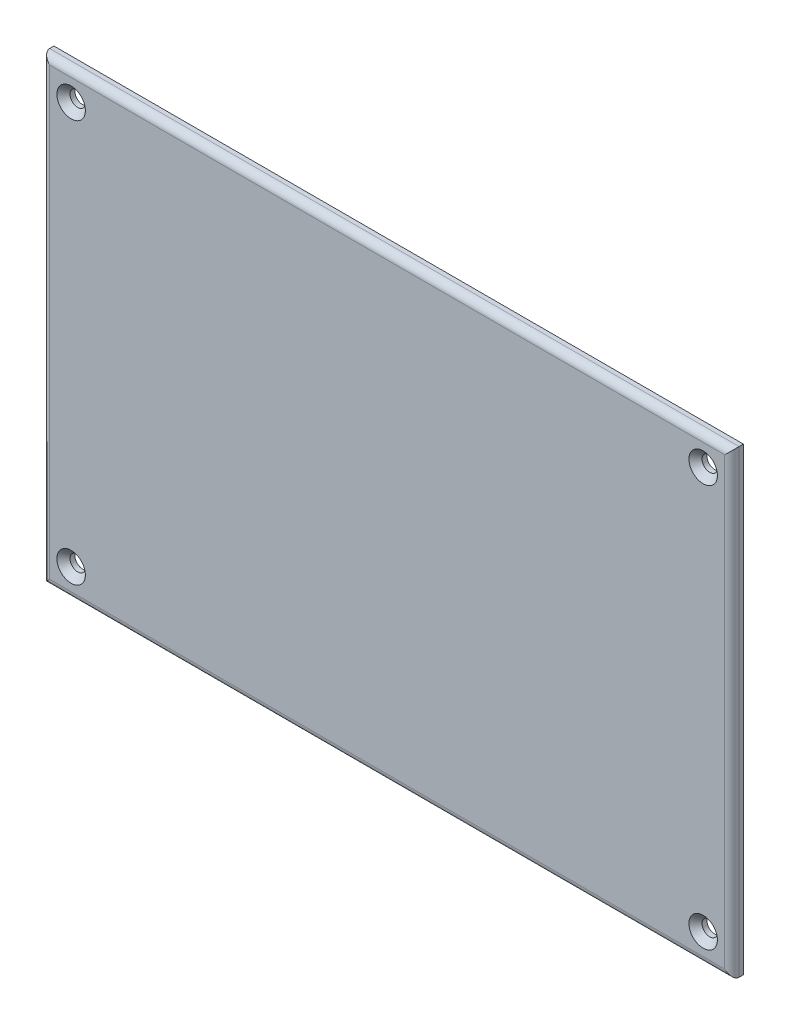
from build123d import *

# Parameters (mm, degrees)
SKETCH1_W                                       = 152.4
SKETCH1_H                                       = 101.6
BOSS_EXTRUDE1_DEPTH                             = 2.54
FILLET1_R                                       = 1.5875
CSK_FOR_M3_FLAT_HEAD_MACHINE_SCREW1_D           = 3.4
CSK_FOR_M3_FLAT_HEAD_MACHINE_SCREW1_DEPTH       = 6.35
CSK_FOR_M3_FLAT_HEAD_MACHINE_SCREW1_CSINK_D     = 6.3
CSK_FOR_M3_FLAT_HEAD_MACHINE_SCREW1_CSINK_ANGLE = 90
CSK_FOR_M3_FLAT_HEAD_MACHINE_SCREW1_TIP         = 1.021463052


with BuildPart() as part:
    # Sketch1 → Boss-Extrude1 (new body)
    with BuildSketch(Plane.XY):
        with Locations((76.2, 50.8)):
            Rectangle(SKETCH1_W, SKETCH1_H)
    extrude(amount=BOSS_EXTRUDE1_DEPTH)

    # Fillet1
    fillet1_edges = [part.edges().sort_by_distance(p)[0] for p in [
        (152.4, 50.8, 2.54),
        (76.2, 101.6, 2.54),
        (0, 50.8, 2.54),
        (76.2, 0, 2.54),
    ]]
    fillet(fillet1_edges, radius=FILLET1_R)

    # CSK for M3 Flat Head Machine Screw1
    with Locations(Plane.XY.offset(2.54)):
        with Locations((6.35, 95.25), (6.35, 6.35), (146.05, 6.35), (146.05, 95.25)):
            CounterSinkHole(CSK_FOR_M3_FLAT_HEAD_MACHINE_SCREW1_D / 2, CSK_FOR_M3_FLAT_HEAD_MACHINE_SCREW1_CSINK_D / 2, depth=CSK_FOR_M3_FLAT_HEAD_MACHINE_SCREW1_DEPTH, counter_sink_angle=CSK_FOR_M3_FLAT_HEAD_MACHINE_SCREW1_CSINK_ANGLE)
            with Locations((0, 0, -(CSK_FOR_M3_FLAT_HEAD_MACHINE_SCREW1_DEPTH + CSK_FOR_M3_FLAT_HEAD_MACHINE_SCREW1_TIP / 2))):  # 118° drill point
                Cone(0, CSK_FOR_M3_FLAT_HEAD_MACHINE_SCREW1_D / 2, CSK_FOR_M3_FLAT_HEAD_MACHINE_SCREW1_TIP, mode=Mode.SUBTRACT)


solid = part.part
